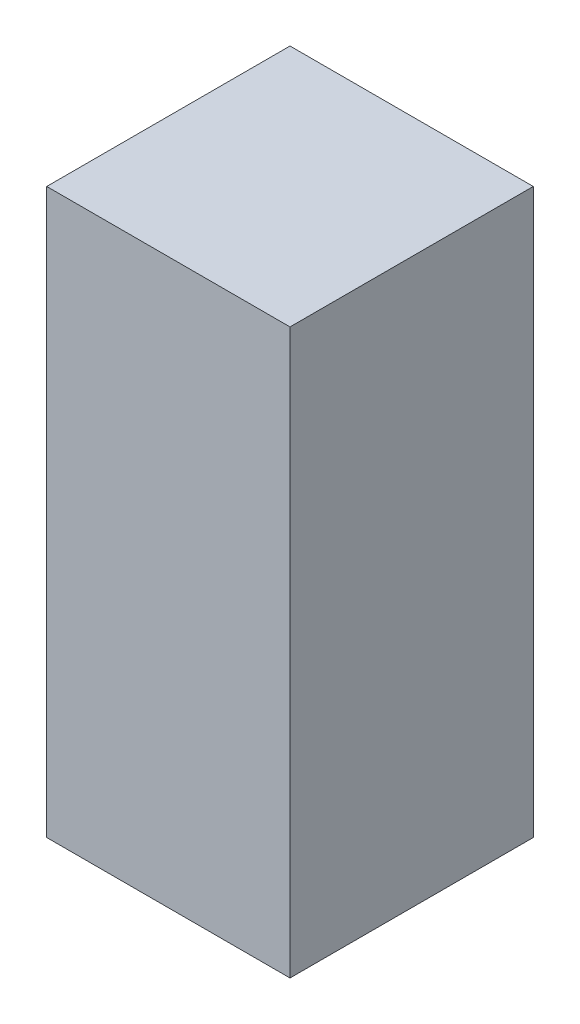
from build123d import *

# Parameters (mm, degrees)
SKETCH1_W           = 38.354
SKETCH1_H           = 38.354
BOSS_EXTRUDE1_DEPTH = 88.9


with BuildPart() as part:
    # Sketch1 → Boss-Extrude1 (new body)
    with BuildSketch(Plane(origin=(0, 0, 0), x_dir=(1, 0, 0), z_dir=(0, 1, 0))):
        with Locations((19.177, 19.177)):
            Rectangle(SKETCH1_W, SKETCH1_H)
    extrude(amount=BOSS_EXTRUDE1_DEPTH)


solid = part.part
